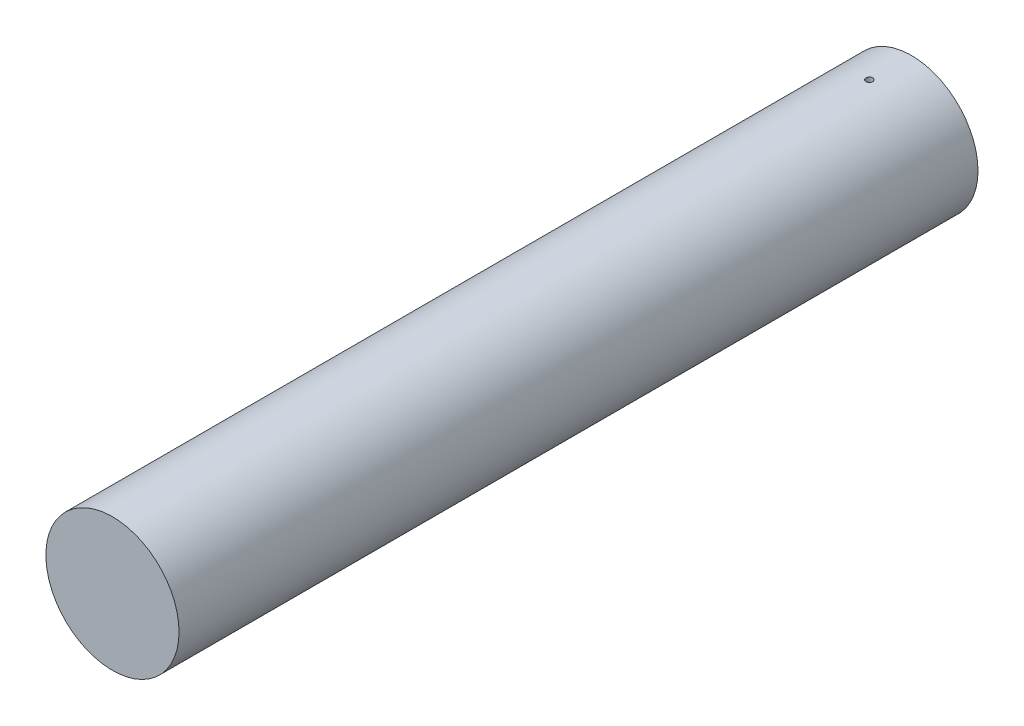
from build123d import *

# Parameters (mm, degrees)
SCHIZZO1_R                    = 100
ESTRUSIONE_ESTRUSIONE1_DEPTH  = 1200
TAGLIO_ESTRUSIONE1_DEPTH      = 1209.304597359
TAGLIO_ESTRUSIONE1_DEPTH_BACK = 1209.304597359
SCHIZZO2_R                    = 5


with BuildPart() as part:
    # Schizzo1 → Estrusione-Estrusione1 (new body)
    with BuildSketch(Plane.XY):
        Circle(SCHIZZO1_R)
    extrude(amount=ESTRUSIONE_ESTRUSIONE1_DEPTH)

    # Schizzo2 → Taglio-Estrusione1 (cut, two sides: drawn at the far end of the back side and taken through both)
    with BuildSketch(Plane(origin=(0, 0, 0), x_dir=(1, 0, 0), z_dir=(0, 1, 0)).offset(-TAGLIO_ESTRUSIONE1_DEPTH_BACK)):
        with Locations(Location((0, -63.218736168, 0), (0, 0, 270))):
            Circle(SCHIZZO2_R)
    extrude(amount=TAGLIO_ESTRUSIONE1_DEPTH + TAGLIO_ESTRUSIONE1_DEPTH_BACK, mode=Mode.SUBTRACT)


solid = part.part
